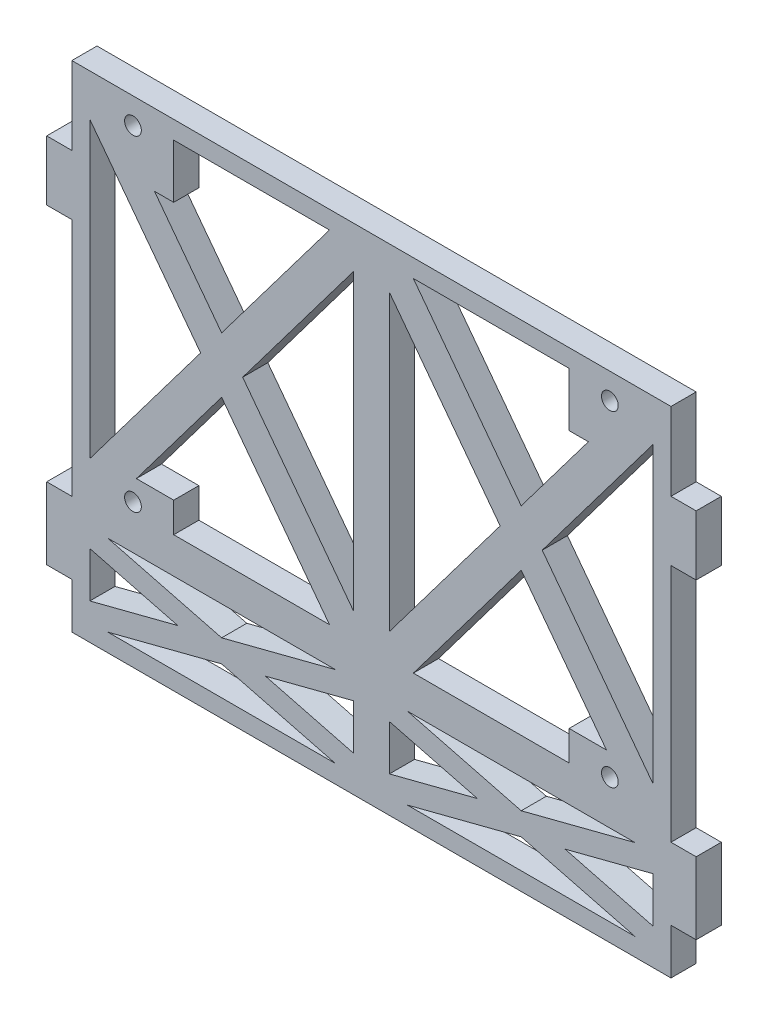
from build123d import *

# Parameters (mm, degrees)
SKETCH1_W                = 127
SKETCH1_H                = 80
TOP_DEPTH                = 5.334
SKETCH2_W                = 127
SKETCH2_H                = 5.334
BOTTOM_DEPTH             = 24.923365698
SKETCH4_W                = 5.334
SKETCH4_H                = 15.24
SKETCH4_H_2              = 12.7
RIGHTTOOTH_DEPTH         = 5.334
SKETCH5_W                = 5.334
SKETCH5_H                = 15.24
SKETCH5_H_2              = 12.7
LEFTTOOTH_DEPTH          = 5.334
SKETCH6_R                = 1.775
PERFBOARDSCREWCUTS_DEPTH = 95.771380308
DESIGN_DEPTH             = 5.334


with BuildPart() as part:
    # Sketch1 → Top (new body)
    with BuildSketch(Plane.XY):
        Rectangle(SKETCH1_W, SKETCH1_H)
    extrude(amount=-TOP_DEPTH)

    # Sketch2 → Bottom (add)
    with BuildSketch(Plane.XZ.offset(40)):
        with Locations((0, -2.667)):
            Rectangle(SKETCH2_W, SKETCH2_H)
    extrude(amount=BOTTOM_DEPTH)

    # Sketch4 → RightTooth (add)
    with BuildSketch(Plane(origin=(63.5, 0, 0), x_dir=(0, 0, -1), z_dir=(1, 0, 0))):
        with Locations((2.667, -47.62)):
            Rectangle(SKETCH4_W, SKETCH4_H)
        with Locations((2.667, 17.15)):
            Rectangle(SKETCH4_W, SKETCH4_H_2)
    extrude(amount=RIGHTTOOTH_DEPTH)

    # Sketch5 → LeftTooth (add)
    with BuildSketch(Plane.ZY.offset(63.5)):
        with Locations((-2.667, -47.62)):
            Rectangle(SKETCH5_W, SKETCH5_H)
        with Locations((-2.667, 17.15)):
            Rectangle(SKETCH5_W, SKETCH5_H_2)
    extrude(amount=LEFTTOOTH_DEPTH)

    # Sketch6 → PerfBoardScrewCuts (cut, through all)
    with BuildSketch(Plane.XY):
        with Locations((-50.546, 34.544)):
            Circle(SKETCH6_R)
        with Locations((50.546, 34.544)):
            Circle(SKETCH6_R)
        with Locations((50.546, -34.544)):
            Circle(SKETCH6_R)
        with Locations((-50.546, -34.544)):
            Circle(SKETCH6_R)
    extrude(amount=-PERFBOARDSCREWCUTS_DEPTH, mode=Mode.SUBTRACT)

    # Sketch7 → Design (cut)
    with BuildSketch(Plane.XY):
        Polygon((-36.205413156, -0.032550322), (-59.69, 31.11), (-59.69, -31.175100644), align=None)
        Polygon((-41.91, 24.76), (-45.9906408, 24.76), (-31.75, 5.87570471), (-8.89, 36.19), (-41.91, 36.19), align=None)
        Polygon((-8.89, -36.255100644), (-31.75, -5.940805354), (-49.821467111, -29.905100644), (-41.91, -29.905100644), (-41.91, -36.255100644), align=None)
        Polygon((-3.81, 31.11), (-27.294586844, -0.032550322), (-3.81, -31.175100644), align=None)
        Polygon((3.81, -31.175100644), (27.294586844, -0.032550322), (3.81, 31.11), align=None)
        Polygon((45.9906408, 24.76), (41.91, 24.76), (41.91, 36.19), (8.89, 36.19), (31.75, 5.87570471), align=None)
        Polygon((59.69, 31.11), (36.205413156, -0.032550322), (59.69, -31.175100644), align=None)
        Polygon((49.821467111, -29.905100644), (31.75, -5.940805354), (8.89, -36.255100644), (41.91, -36.255100644), (41.91, -29.905100644), align=None)
        Polygon((55.88, -43.875100644), (7.62, -43.875100644), (31.75, -50.097955181), align=None)
        Polygon((59.69, -47.685100644), (41.041907363, -52.494233171), (59.69, -57.303365698), align=None)
        Polygon((55.88, -61.113365698), (31.75, -54.890511161), (7.62, -61.113365698), align=None)
        Polygon((3.81, -57.303365698), (22.458092637, -52.494233171), (3.81, -47.685100644), align=None)
        Polygon((-3.81, -47.685100644), (-22.458092637, -52.494233171), (-3.81, -57.303365698), align=None)
        Polygon((-55.88, -43.875100644), (-31.75, -50.097955181), (-7.62, -43.875100644), align=None)
        Polygon((-41.041907363, -52.494233171), (-59.69, -47.685100644), (-59.69, -57.303365698), align=None)
        Polygon((-7.62, -61.113365698), (-31.75, -54.890511161), (-55.88, -61.113365698), align=None)
    extrude(amount=-DESIGN_DEPTH, mode=Mode.SUBTRACT)


solid = part.part
